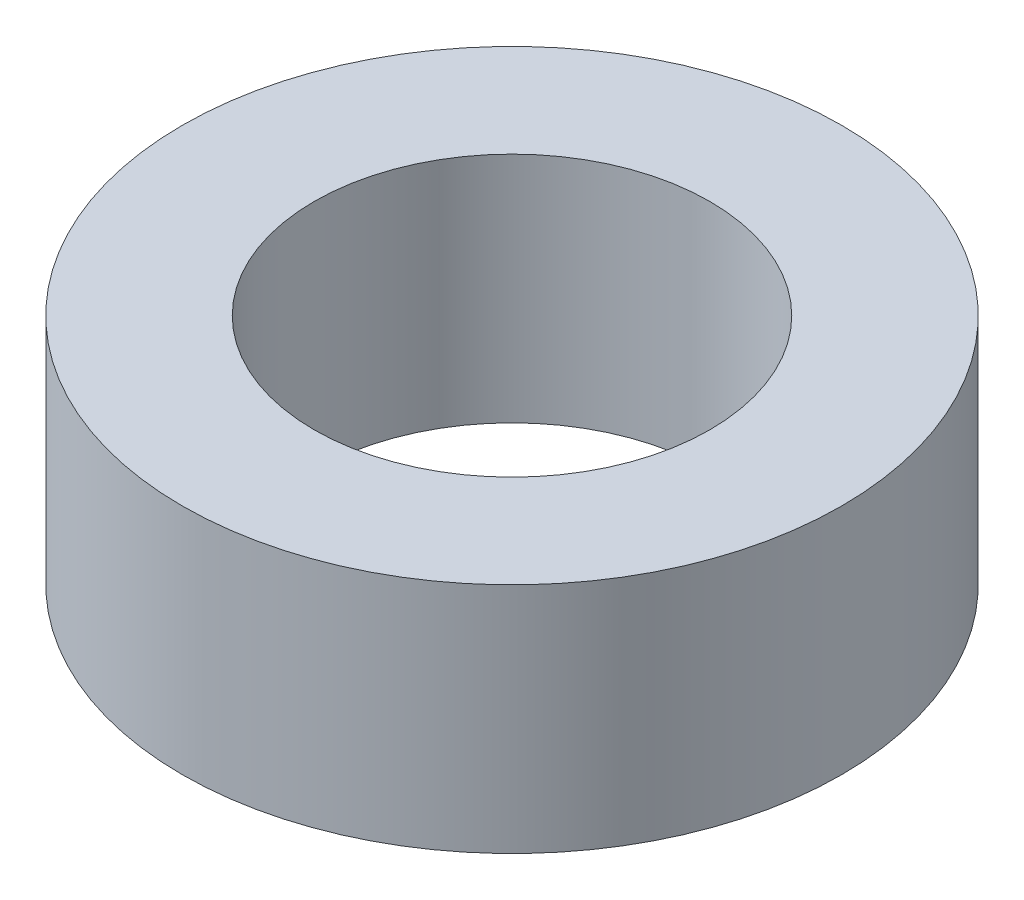
from build123d import *

# Parameters (mm, degrees)
SKETCH1_R                         = 17
SKETCH1_R_2                       = 10.2
REVOLVED_EQUIVALENT_EXTRUDE_DEPTH = 12


with BuildPart() as part:
    # Sketch1 → Revolved_Equivalent_Extrude (new body)
    with BuildSketch(Plane(origin=(0, 0, 0), x_dir=(1, 0, 0), z_dir=(0, 1, 0))):
        with Locations(Location((0, 0, 0), (0, 0, 270))):
            Circle(SKETCH1_R)
        with Locations(Location((0, 0, 0), (0, 0, 270))):
            Circle(SKETCH1_R_2, mode=Mode.SUBTRACT)
    extrude(amount=REVOLVED_EQUIVALENT_EXTRUDE_DEPTH)


solid = part.part
